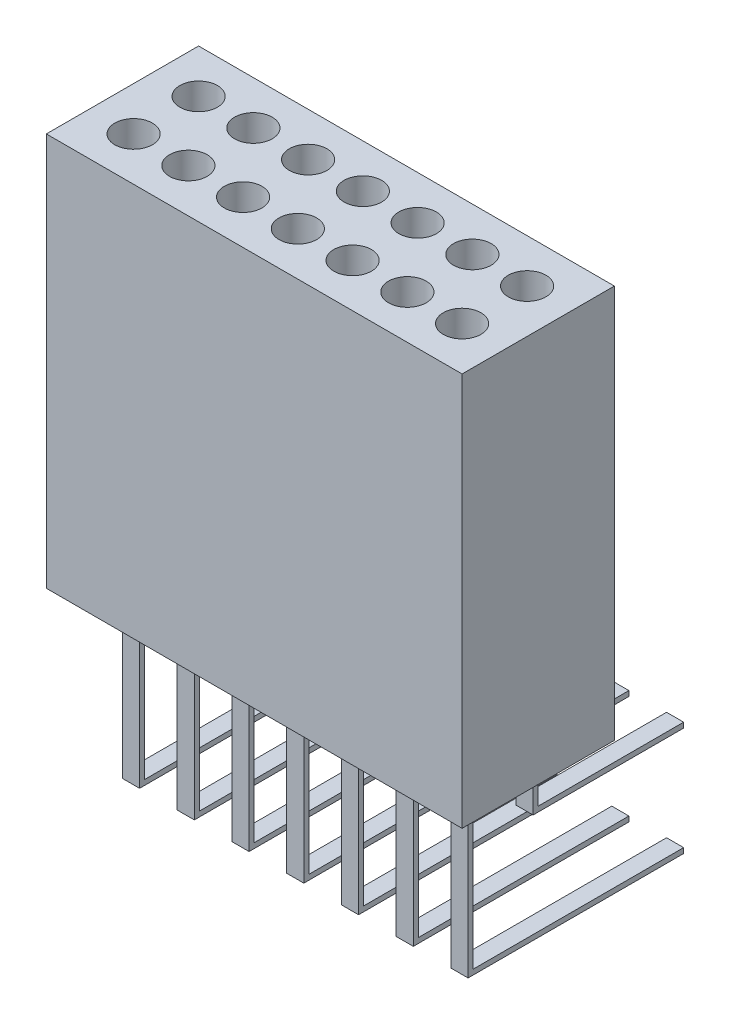
from build123d import *

# Parameters (mm, degrees)
SKETCH2_W           = 4.86
SKETCH2_H           = 1.78
BOSS_EXTRUDE1_DEPTH = 4.6
SKETCH3_R           = 0.22
CUT_EXTRUDE1_DEPTH  = 4.5
SKETCH4_W           = 0.2
SKETCH4_H           = 0.06
BOSS_EXTRUDE2_DEPTH = 1.96
SKETCH6_W           = 0.2
SKETCH6_H           = 0.06
BOSS_EXTRUDE3_DEPTH = 0.69
SKETCH7_W           = 0.2
SKETCH7_H           = 0.06
BOSS_EXTRUDE4_DEPTH = 1.7
SKETCH8_W           = 0.2
SKETCH8_H           = 0.06
BOSS_EXTRUDE5_DEPTH = 2.46


with BuildPart() as part:
    # Sketch2 → Boss-Extrude1 (new body)
    with BuildSketch(Plane(origin=(0, 0, 0), x_dir=(1, 0, 0), z_dir=(0, 1, 0))):
        with Locations((2.43, 0.89)):
            Rectangle(SKETCH2_W, SKETCH2_H)
    extrude(amount=BOSS_EXTRUDE1_DEPTH)

    # Sketch3 → Cut-Extrude1 (cut)
    with BuildSketch(Plane(origin=(0, 4.6, 0), x_dir=(1, 0, 0), z_dir=(0, 1, 0))):
        with Locations(Location((0.51, 1.27, 0), (0, 0, 270))):
            Circle(SKETCH3_R)
        with Locations(Location((1.15, 1.27, 0), (0, 0, 270))):
            Circle(SKETCH3_R)
        with Locations(Location((1.79, 1.27, 0), (0, 0, 270))):
            Circle(SKETCH3_R)
        with Locations(Location((2.43, 1.27, 0), (0, 0, 270))):
            Circle(SKETCH3_R)
        with Locations(Location((3.07, 1.27, 0), (0, 0, 270))):
            Circle(SKETCH3_R)
        with Locations(Location((3.71, 1.27, 0), (0, 0, 270))):
            Circle(SKETCH3_R)
        with Locations(Location((4.35, 1.27, 0), (0, 0, 270))):
            Circle(SKETCH3_R)
        with Locations(Location((1.15, 0.51, 0), (0, 0, 270))):
            Circle(SKETCH3_R)
        with Locations(Location((1.79, 0.51, 0), (0, 0, 270))):
            Circle(SKETCH3_R)
        with Locations(Location((2.43, 0.51, 0), (0, 0, 270))):
            Circle(SKETCH3_R)
        with Locations(Location((3.07, 0.51, 0), (0, 0, 270))):
            Circle(SKETCH3_R)
        with Locations(Location((3.71, 0.51, 0), (0, 0, 270))):
            Circle(SKETCH3_R)
        with Locations(Location((4.35, 0.51, 0), (0, 0, 270))):
            Circle(SKETCH3_R)
        with Locations(Location((0.51, 0.51, 0), (0, 0, 270))):
            Circle(SKETCH3_R)
    extrude(amount=-CUT_EXTRUDE1_DEPTH, mode=Mode.SUBTRACT)

    # Sketch4 → Boss-Extrude2 (add)
    with BuildSketch(Plane.XZ):
        with Locations((0.51, -0.51)):
            Rectangle(SKETCH4_W, SKETCH4_H)
        with Locations((1.15, -0.51)):
            Rectangle(SKETCH4_W, SKETCH4_H)
        with Locations((1.79, -0.51)):
            Rectangle(SKETCH4_W, SKETCH4_H)
        with Locations((2.43, -0.51)):
            Rectangle(SKETCH4_W, SKETCH4_H)
        with Locations((3.07, -0.51)):
            Rectangle(SKETCH4_W, SKETCH4_H)
        with Locations((3.71, -0.51)):
            Rectangle(SKETCH4_W, SKETCH4_H)
        with Locations((4.35, -0.51)):
            Rectangle(SKETCH4_W, SKETCH4_H)
    extrude(amount=BOSS_EXTRUDE2_DEPTH)

    # Sketch6 → Boss-Extrude3 (add)
    with BuildSketch(Plane.XZ):
        with Locations((0.51, -1.27)):
            Rectangle(SKETCH6_W, SKETCH6_H)
        with Locations((1.15, -1.27)):
            Rectangle(SKETCH6_W, SKETCH6_H)
        with Locations((1.79, -1.27)):
            Rectangle(SKETCH6_W, SKETCH6_H)
        with Locations((2.43, -1.27)):
            Rectangle(SKETCH6_W, SKETCH6_H)
        with Locations((3.07, -1.27)):
            Rectangle(SKETCH6_W, SKETCH6_H)
        with Locations((3.71, -1.27)):
            Rectangle(SKETCH6_W, SKETCH6_H)
        with Locations((4.35, -1.27)):
            Rectangle(SKETCH6_W, SKETCH6_H)
    extrude(amount=BOSS_EXTRUDE3_DEPTH)

    # Sketch7 → Boss-Extrude4 (add)
    with BuildSketch(Plane(origin=(0, 0, -1.3), x_dir=(-1, 0, 0), z_dir=(0, 0, -1))):
        with Locations((-4.35, -0.66)):
            Rectangle(SKETCH7_W, SKETCH7_H)
        with Locations((-3.71, -0.66)):
            Rectangle(SKETCH7_W, SKETCH7_H)
        with Locations((-3.07, -0.66)):
            Rectangle(SKETCH7_W, SKETCH7_H)
        with Locations((-2.43, -0.66)):
            Rectangle(SKETCH7_W, SKETCH7_H)
        with Locations((-1.79, -0.66)):
            Rectangle(SKETCH7_W, SKETCH7_H)
        with Locations((-1.15, -0.66)):
            Rectangle(SKETCH7_W, SKETCH7_H)
        with Locations((-0.51, -0.66)):
            Rectangle(SKETCH7_W, SKETCH7_H)
    extrude(amount=BOSS_EXTRUDE4_DEPTH)

    # Sketch8 → Boss-Extrude5 (add)
    with BuildSketch(Plane(origin=(0, 0, -0.54), x_dir=(-1, 0, 0), z_dir=(0, 0, -1))):
        with Locations((-4.35, -1.93)):
            Rectangle(SKETCH8_W, SKETCH8_H)
        with Locations((-3.71, -1.93)):
            Rectangle(SKETCH8_W, SKETCH8_H)
        with Locations((-3.07, -1.93)):
            Rectangle(SKETCH8_W, SKETCH8_H)
        with Locations((-2.43, -1.93)):
            Rectangle(SKETCH8_W, SKETCH8_H)
        with Locations((-1.79, -1.93)):
            Rectangle(SKETCH8_W, SKETCH8_H)
        with Locations((-1.15, -1.93)):
            Rectangle(SKETCH8_W, SKETCH8_H)
        with Locations((-0.51, -1.93)):
            Rectangle(SKETCH8_W, SKETCH8_H)
    extrude(amount=BOSS_EXTRUDE5_DEPTH)


solid = part.part
